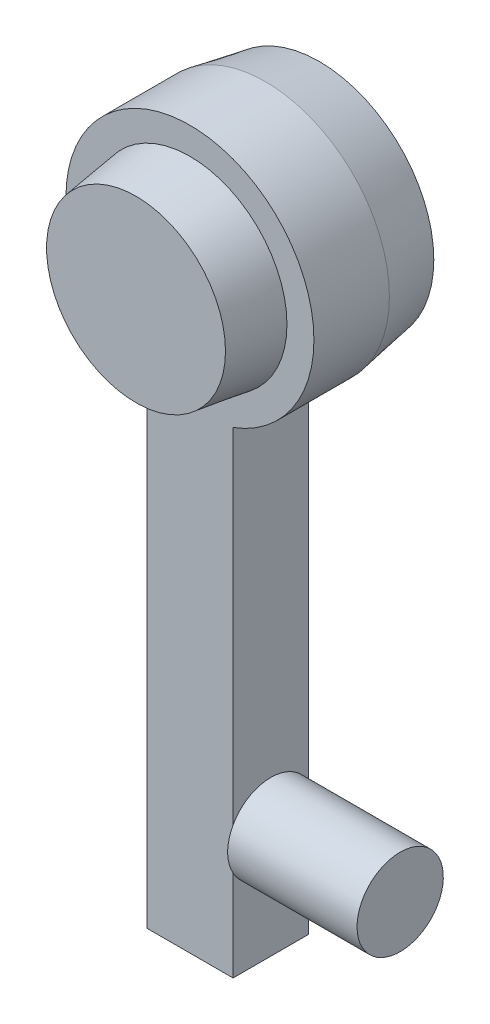
from build123d import *

# Parameters (mm, degrees)
BOSS_EXTRUDE1_DEPTH = 7
SKETCH2_R           = 9
BOSS_EXTRUDE2_DEPTH = 5
BOSS_EXTRUDE2_TAPER = 8
SKETCH4_R           = 11.5
BOSS_EXTRUDE3_DEPTH = 5
BOSS_EXTRUDE3_TAPER = 10
SKETCH5_R           = 4
BOSS_EXTRUDE4_DEPTH = 12
SKETCH6_R           = 9
CUT_EXTRUDE1_DEPTH  = 5
SKETCH7_R           = 9
CUT_EXTRUDE3_DEPTH  = 5
CUT_EXTRUDE3_DRAFT  = -10


with BuildPart() as part:
    # Sketch1 → Boss-Extrude1 (new body)
    with BuildSketch(Plane.XY):
        with BuildLine():
            Line((-4, -10.781929326), (-4, -55))
            Line((-4, -55), (4, -55))
            Line((4, -55), (4, -10.781929326))
            ThreePointArc((4, -10.781929326), (0, 11.5), (-4, -10.781929326))
        make_face()
    extrude(amount=-BOSS_EXTRUDE1_DEPTH)

    # Sketch2 → Boss-Extrude2 (add)
    with BuildSketch(Plane.XY):
        Circle(SKETCH2_R)
    extrude(amount=BOSS_EXTRUDE2_DEPTH, taper=BOSS_EXTRUDE2_TAPER)

    # Sketch4 → Boss-Extrude3 (add)
    with BuildSketch(Plane(origin=(0, 0, -7), x_dir=(-1, 0, 0), z_dir=(0, 0, -1))):
        Circle(SKETCH4_R)
    extrude(amount=BOSS_EXTRUDE3_DEPTH, taper=BOSS_EXTRUDE3_TAPER)

    # Sketch5 → Boss-Extrude4 (add)
    with BuildSketch(Plane(origin=(4, 0, 0), x_dir=(0, 0, -1), z_dir=(1, 0, 0))):
        with Locations(Location((3.5, -44.64, 0), (0, 0, 208.955024372))):
            Circle(SKETCH5_R)
    extrude(amount=BOSS_EXTRUDE4_DEPTH)

    # Sketch6 → Cut-Extrude1 (cut)
    with BuildSketch(Plane(origin=(0, 0, -12), x_dir=(-1, 0, 0), z_dir=(0, 0, -1))):
        Circle(SKETCH6_R)
    extrude(amount=-CUT_EXTRUDE1_DEPTH, mode=Mode.SUBTRACT)


with BuildPart() as cut_extrude3_tool:
    # Sketch7 → Cut-Extrude3 (with draft: the straight prism first)
    with BuildSketch(Plane(origin=(0, 0, -7), x_dir=(-1, 0, 0), z_dir=(0, 0, -1))):
        Circle(SKETCH7_R)
    extrude(amount=CUT_EXTRUDE3_DEPTH)
    # Cut-Extrude3: the draft: its side faces are tilted about the plane it starts from
    cut_extrude3_sides = [cut_extrude3_tool.faces().sort_by_distance(p)[0] for p in [
        (9, 0, -9.5),
    ]]
    draft(cut_extrude3_sides, Plane(origin=(0, 0, -7), x_dir=(-1, 0, 0), z_dir=(0, 0, -1)), CUT_EXTRUDE3_DRAFT)


with BuildPart() as part_1:
    add(part.part)

    # Cut-Extrude3: cut by cut_extrude3_tool
    add(cut_extrude3_tool.part, mode=Mode.SUBTRACT)


solid = part_1.part
